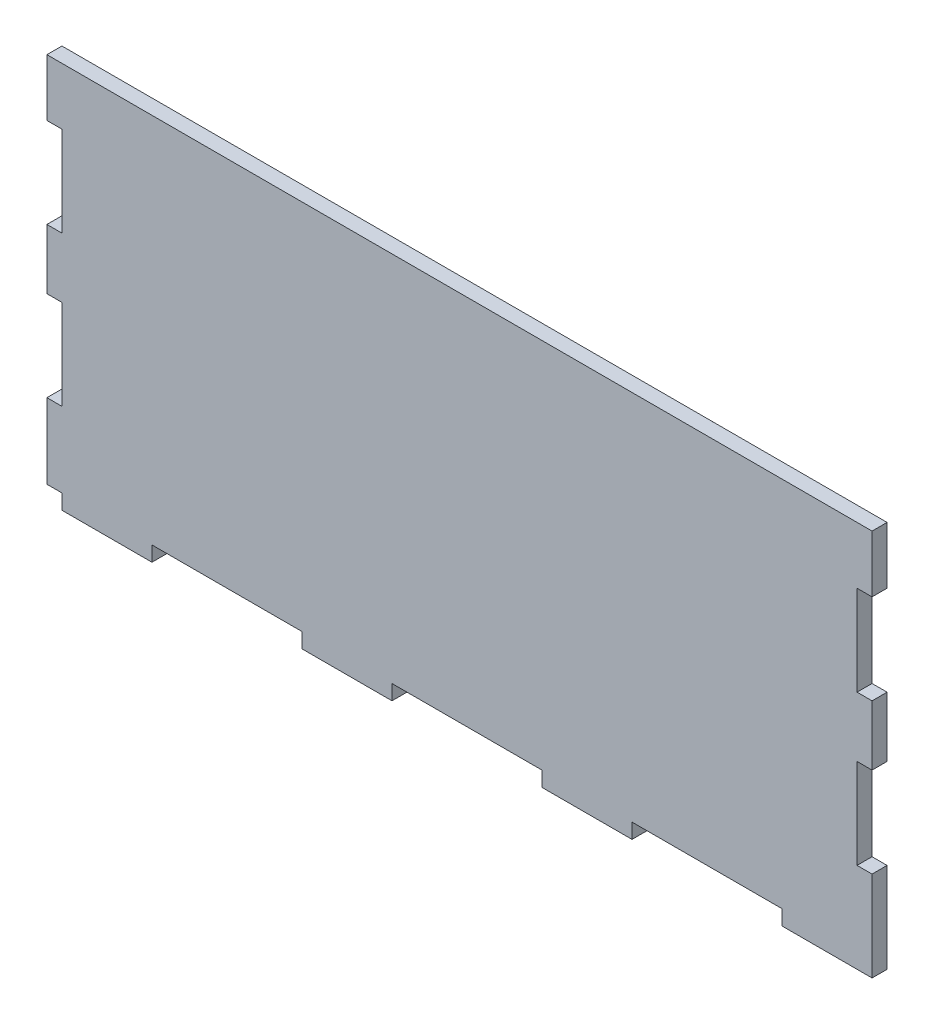
from build123d import *

# Parameters (mm, degrees)
BOSS_EXTRUDE1_DEPTH = 5


with BuildPart() as part:
    # Sketch1 → Boss-Extrude1 (new body)
    with BuildSketch(Plane.XY):
        Polygon((180, -49), (180, -19), (175, -19), (175, 0), (180, 0), (450, 0), (450, -19), (445, -19), (445, -49), (450, -49), (450, -69), (445, -69), (445, -99), (450, -99), (450, -124), (450, -129), (420, -129), (420, -124), (370, -124), (370, -129), (340, -129), (340, -124), (290, -124), (290, -129), (260, -129), (260, -124), (210, -124), (210, -129), (180, -129), (180, -124), (175, -124), (175, -99), (180, -99), (180, -69), (175, -69), (175, -49), align=None)
    extrude(amount=BOSS_EXTRUDE1_DEPTH)


solid = part.part
